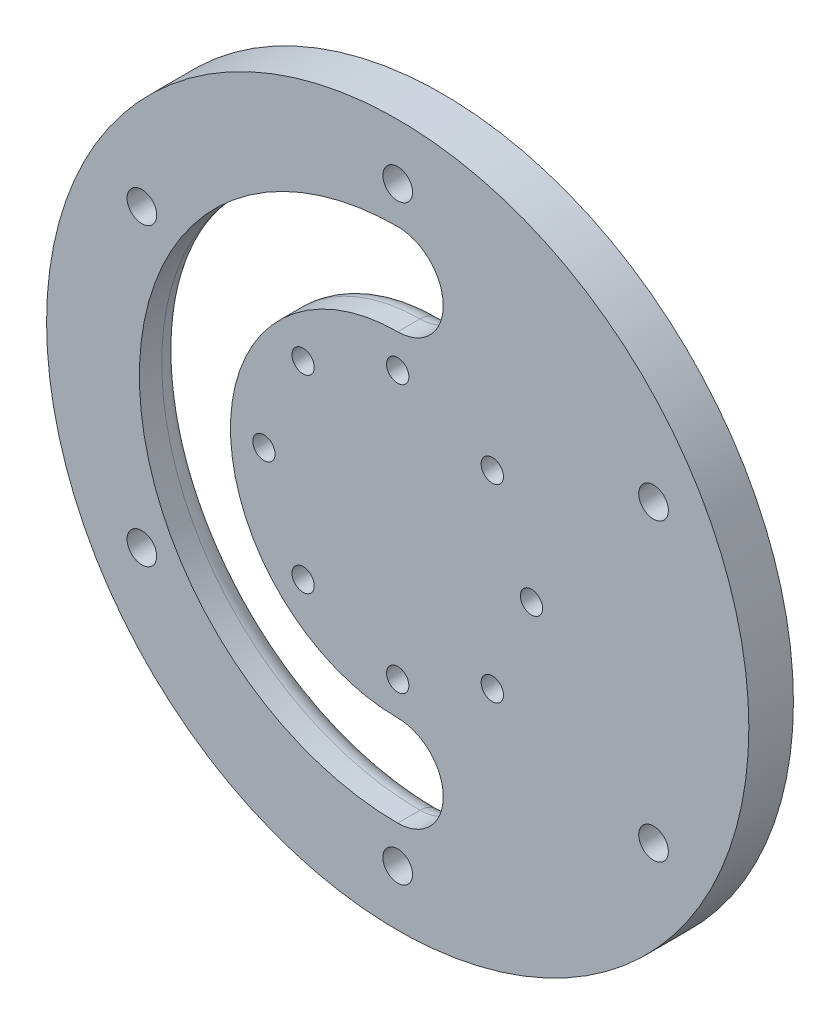
from build123d import *

# Parameters (mm, degrees)
SKETCH1_R                               = 31.5
ELBOW_PLATE_DEPTH                       = 4
SKETCH3_R                               = 1.33
SCREW_HOLES_DEPTH                       = 45.726949371
CABLE_SLOT_DEPTH                        = 4
FILLET1_R                               = 2
CBORE_FOR_M6_HEX_HEAD_BOLT1_D           = 2
CBORE_FOR_M6_HEX_HEAD_BOLT1_CBORE_D     = 3.5
CBORE_FOR_M6_HEX_HEAD_BOLT1_CBORE_DEPTH = 1


with BuildPart() as part:
    # Sketch1 → Elbow Plate (new body)
    with BuildSketch(Plane.XY):
        Circle(SKETCH1_R)
    extrude(amount=ELBOW_PLATE_DEPTH)

    # Sketch3 → Screw Holes (cut, through all)
    with BuildSketch(Plane(origin=(0, 0, 0), x_dir=(-1, 0, 0), z_dir=(0, 0, -1))):
        with Locations((22.9496732, 13.25)):
            Circle(SKETCH3_R)
        with Locations((0, 26.5)):
            Circle(SKETCH3_R)
        with Locations((22.9496732, -13.25)):
            Circle(SKETCH3_R)
        with Locations((0, -26.5)):
            Circle(SKETCH3_R)
        with Locations((-22.9496732, -13.25)):
            Circle(SKETCH3_R)
        with Locations((-22.9496732, 13.25)):
            Circle(SKETCH3_R)
    extrude(amount=-SCREW_HOLES_DEPTH, mode=Mode.SUBTRACT)

    # Sketch4 → Cable Slot (cut)
    with BuildSketch(Plane.XY.offset(4)):
        with BuildLine():
            ThreePointArc((0, -23.172318516), (4.086159258, -19.086159258), (0, -15))
            ThreePointArc((0, -15), (-15, 0), (0, 15))
            ThreePointArc((0, 15), (4.086159258, 19.086159258), (0, 23.172318516))
            ThreePointArc((0, 23.172318516), (-23.172318516, 0), (0, -23.172318516))
        make_face()
    extrude(amount=-CABLE_SLOT_DEPTH, mode=Mode.SUBTRACT)

    # Fillet1
    fillet1_edges = [part.edges().sort_by_distance(p)[0] for p in [
        (-23.172318516, 0, 0),
        (4.086159258, 19.086159258, 0),
        (-15, 0, 0),
        (4.086159258, -19.086159258, 0),
    ]]
    fillet(fillet1_edges, radius=FILLET1_R)

    # CBORE for M6 Hex Head Bolt1 (through all)
    with Locations(Plane(origin=(12, 0, 0), x_dir=(-1, 0, 0), z_dir=(0, 0, -1))):
        with Locations((0, 0), (3.514718626, 8.485281374), (12, 12), (20.485281374, 8.485281374), (24, 0), (20.485281374, -8.485281374), (12, -12), (3.514718626, -8.485281374)):
            CounterBoreHole(CBORE_FOR_M6_HEX_HEAD_BOLT1_D / 2, CBORE_FOR_M6_HEX_HEAD_BOLT1_CBORE_D / 2, CBORE_FOR_M6_HEX_HEAD_BOLT1_CBORE_DEPTH)


solid = part.part
